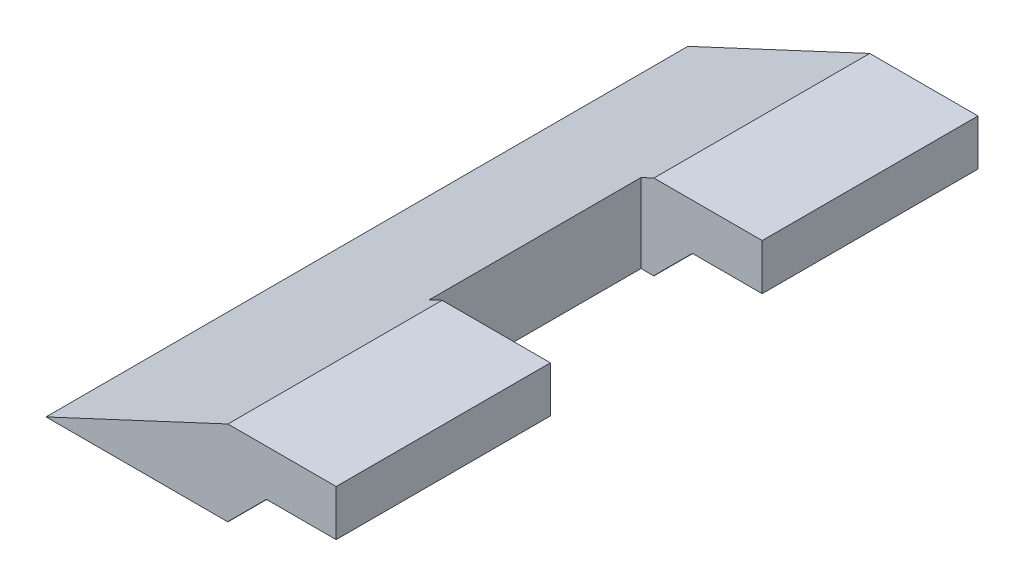
from build123d import *

# Parameters (mm, degrees)
EXTRUDE_1_DEPTH          = 50
CUT_EXTRUDE_1_DEPTH      = 10
CUT_EXTRUDE_1_DEPTH_BACK = 10
SKETCH_2_W               = 9.435028842
SKETCH_2_H               = 16.5


with BuildPart() as part:
    # Эскиз1 → Бобышка-Вытянуть1 (new body)
    with BuildSketch(Plane.XY):
        Polygon((2.867002202, -4.303564356), (2.867002202, -4.282485579), (5.867002202, -1.282485579), (11.302031044, -1.282485579), (11.302031044, 2.303564356), (2.867002202, 2.303564356), (-11.302031044, -4.303564356), align=None)
    extrude(amount=EXTRUDE_1_DEPTH)

    # Эскиз2 → Вырез-Вытянуть1 (cut, two sides: drawn at the far end of the back side and taken through both)
    with BuildSketch(Plane.XZ.offset(1.282485579).offset(-CUT_EXTRUDE_1_DEPTH_BACK)):
        with Locations((6.584516623, 25.063055317)):
            Rectangle(SKETCH_2_W, SKETCH_2_H)
    extrude(amount=CUT_EXTRUDE_1_DEPTH + CUT_EXTRUDE_1_DEPTH_BACK, mode=Mode.SUBTRACT)


solid = part.part
